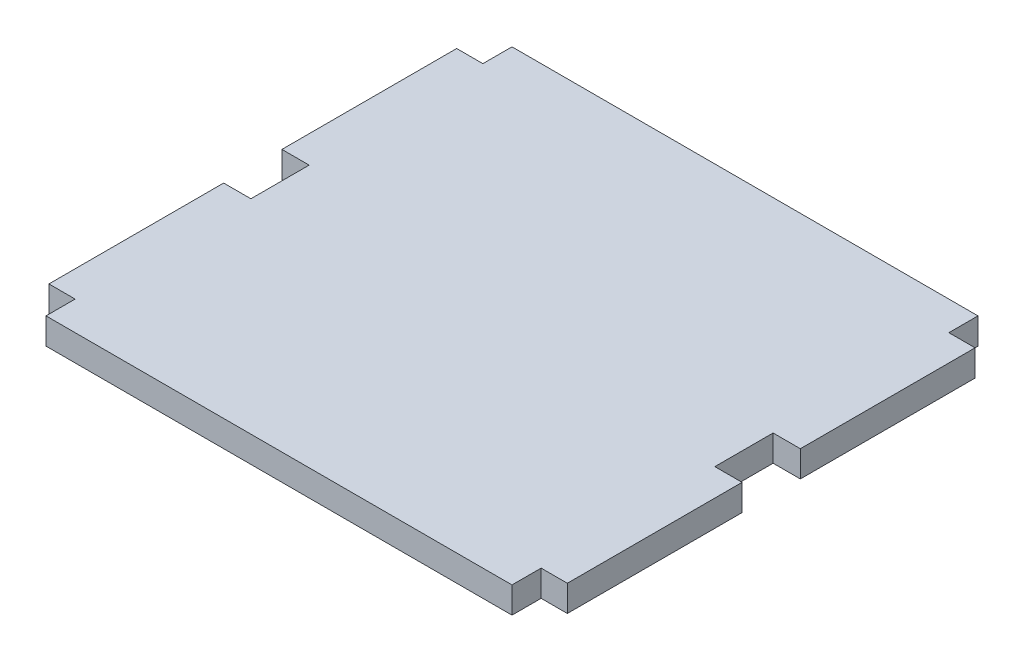
from build123d import *

# Parameters (mm, degrees)
BOSS_EXTRUDE1_DEPTH = 4.5


with BuildPart() as part:
    # Sketch1 → Boss-Extrude1 (new body)
    with BuildSketch(Plane(origin=(0, 0, 0), x_dir=(1, 0, 0), z_dir=(0, 1, 0))):
        Polygon((-40, -35), (-40, -40), (39.824141272, -40), (40, -40), (40, -35), (44.5, -35), (44.5, -32.917902443), (44.5, -5), (39.824141272, -5), (39.824141272, 0), (39.824141272, 5), (44.5, 5), (44.5, 35), (40, 35), (40, 40), (-40, 40), (-40, 35), (-44.5, 35), (-44.5, 5), (-39.824141272, 5), (-39.824141272, 0), (-39.824141272, -5), (-44.5, -5), (-44.5, -35), align=None)
    extrude(amount=BOSS_EXTRUDE1_DEPTH)


solid = part.part
